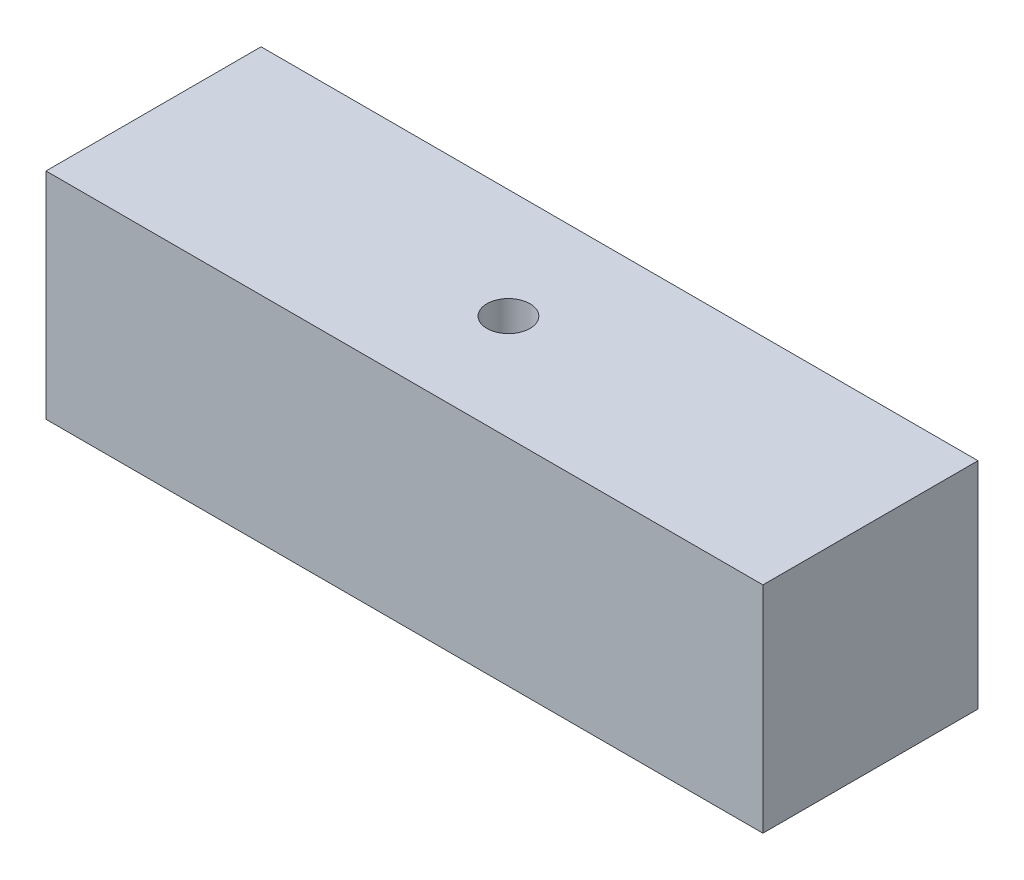
from build123d import *

# Parameters (mm, degrees)
ESQUISSE1_W             = 50
ESQUISSE1_H             = 15
BOSS_EXTRU_1_DEPTH      = 15
ESQUISSE2_R             = 1.5
ENL_V_MAT_EXTRU_1_DEPTH = 5.5


with BuildPart() as part:
    # Esquisse1 → Boss.-Extru.1 (new body)
    with BuildSketch(Plane(origin=(0, 0, 0), x_dir=(1, 0, 0), z_dir=(0, 1, 0))):
        with Locations((-13.920572214, 15.802792295)):
            Rectangle(ESQUISSE1_W, ESQUISSE1_H)
    extrude(amount=BOSS_EXTRU_1_DEPTH)

    # Esquisse2 → Enlèv. mat.-Extru.1 (cut)
    with BuildSketch(Plane(origin=(0, 15, 0), x_dir=(1, 0, 0), z_dir=(0, 1, 0))):
        with Locations(Location((-14.028704299, 15.66379599, 0), (0, 0, 270))):
            Circle(ESQUISSE2_R)
    extrude(amount=-ENL_V_MAT_EXTRU_1_DEPTH, mode=Mode.SUBTRACT)


solid = part.part
